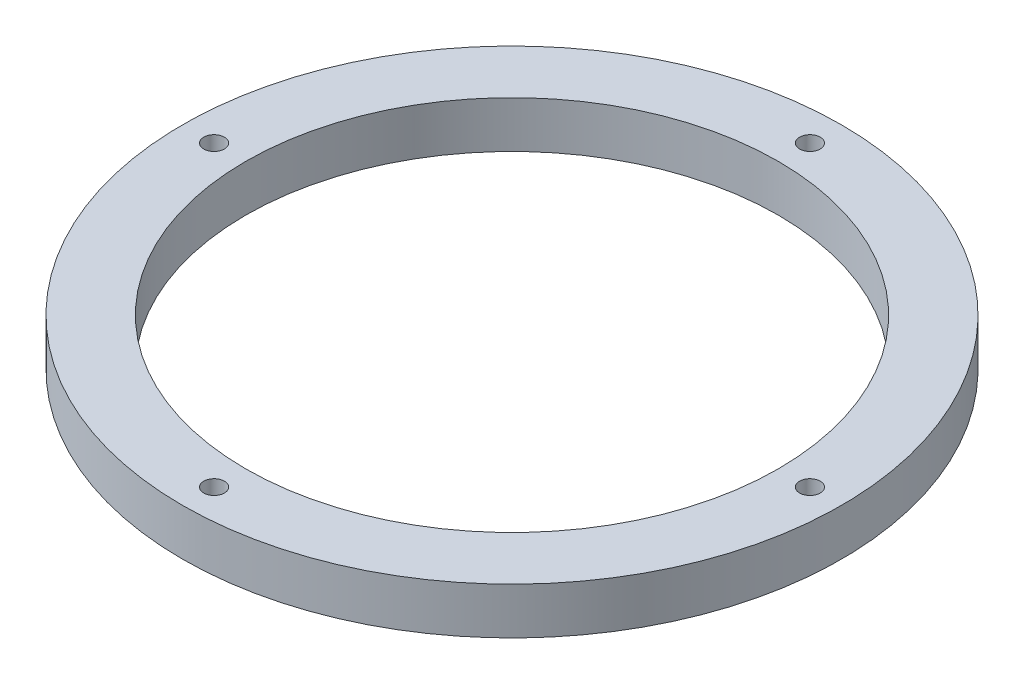
from build123d import *

# Parameters (mm, degrees)
SKETCH_1_R          = 49.5
SKETCH_1_R_2        = 40
EXTRUDE_1_DEPTH     = 7
SKETCH_2_R          = 1.55
CUT_EXTRUDE_1_DEPTH = 7


with BuildPart() as part:
    # 草图1 → 凸台-拉伸1 (new body)
    with BuildSketch(Plane(origin=(0, 0, 0), x_dir=(1, 0, 0), z_dir=(0, 1, 0))):
        with Locations(Location((0, 0, 0), (0, 0, 270))):
            Circle(SKETCH_1_R)
        with Locations(Location((0, 0, 0), (0, 0, 270))):
            Circle(SKETCH_1_R_2, mode=Mode.SUBTRACT)
    extrude(amount=EXTRUDE_1_DEPTH)

    # 草图2 → 切除-拉伸1 (cut)
    with BuildSketch(Plane(origin=(0, 7, 0), x_dir=(1, 0, 0), z_dir=(0, 1, 0))):
        with Locations(Location((-44.75, 0, 0), (0, 0, 270))):
            Circle(SKETCH_2_R)
        with Locations(Location((0, 44.75, 0), (0, 0, 270))):
            Circle(SKETCH_2_R)
        with Locations(Location((44.75, 0, 0), (0, 0, 270))):
            Circle(SKETCH_2_R)
        with Locations(Location((0, -44.75, 0), (0, 0, 270))):
            Circle(SKETCH_2_R)
    extrude(amount=-CUT_EXTRUDE_1_DEPTH, mode=Mode.SUBTRACT)


solid = part.part
